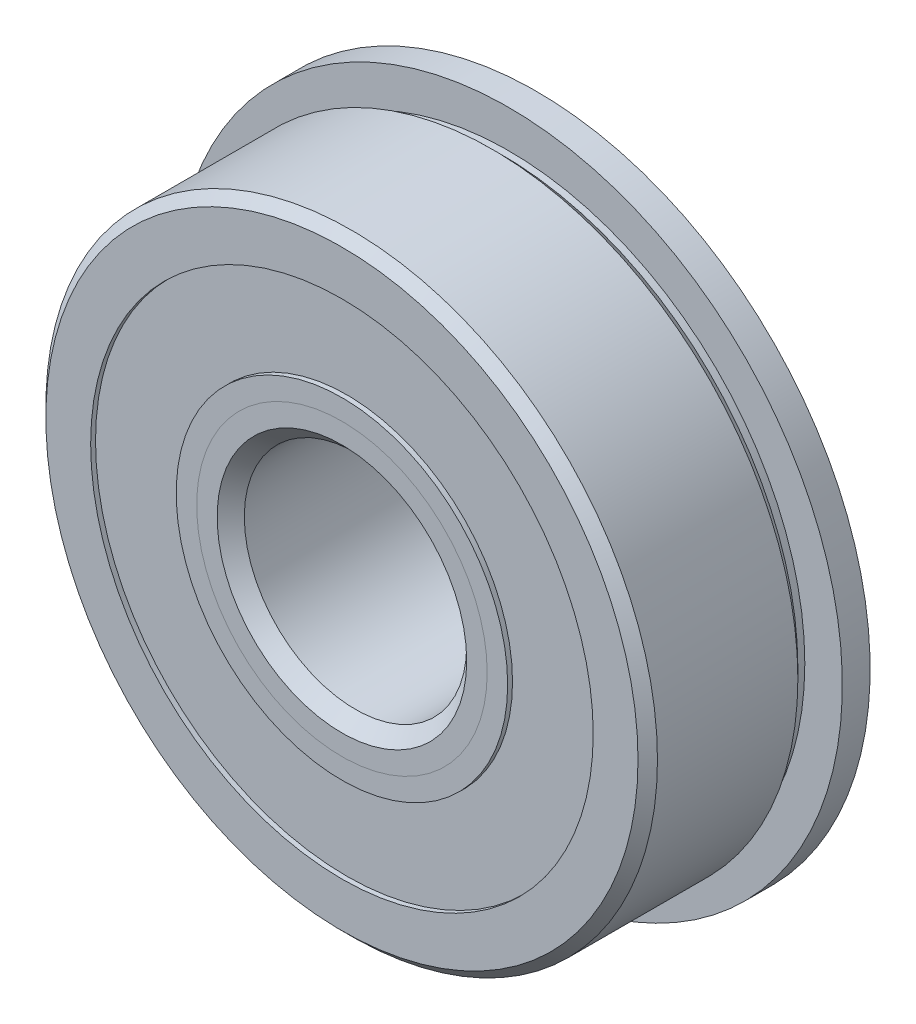
from build123d import *

# Parameters (mm, degrees)
SKETCH5_W          = 1.5875
SKETCH5_H          = 3.422283654
CIRPATTERN1_COUNT  = 12
SKETCH7_W          = 1.272755053
SKETCH7_H          = 4.884615384
SKETCH7_H_2        = 2.842357692
SKETCH9_R          = 9.4360365
SKETCH9_R_2        = 8.9757885
CUT_EXTRUDE1_DEPTH = 0.127
SKETCH10_R         = 12.426696
SKETCH10_R_2       = 11.5062
CUT_EXTRUDE2_DEPTH = 0.254


with BuildPart() as part:
    # Sketch8 → Revolve7 (revolve)
    with BuildSketch(Plane(origin=(0, 0, 0), x_dir=(0, 0, -1), z_dir=(1, 0, 0))):
        with BuildLine():
            Line((5.55625, 16.906875), (5.000625, 17.4625))
            Line((5.000625, 17.4625), (-5.000625, 17.4625))
            Line((-5.000625, 17.4625), (-5.55625, 16.906875))
            Line((-5.55625, 16.906875), (-5.55625, 14.348557692))
            Line((-5.55625, 14.348557692), (-3.175, 14.348557692))
            ThreePointArc((-3.175, 14.348557692), (0, 15.911932447), (3.175, 14.348557692))
            Line((3.175, 14.348557692), (5.55625, 14.348557692))
            Line((5.55625, 14.348557692), (5.55625, 16.906875))
        make_face()
    revolve(axis=Axis((0, 0, 5.55625), (0, 0, -1)))

    # Sketch5 → Revolve5 (revolve)
    with BuildSketch(Plane(origin=(0, 0, 0), x_dir=(0, 0, -1), z_dir=(1, 0, 0))):
        with Locations((4.7625, 17.338858173)):
            Rectangle(SKETCH5_W, SKETCH5_H)
    revolve(axis=Axis((0, 0, -7.14375), (0, 0, 1)))

    # Sketch6 → Cut-Revolve1 (revolve, cut)
    with BuildSketch(Plane(origin=(0, 0, 0), x_dir=(0, 0, -1), z_dir=(1, 0, 0))):
        Polygon((3.01625, 17.4625), (3.571875, 16.906875), (3.96875, 16.906875), (3.96875, 17.4625), align=None)
    revolve(axis=Axis((0, 0, 5.55625), (0, 0, -1)), mode=Mode.SUBTRACT)


with BuildPart() as body_2:
    # Sketch2 → Revolve2 (revolve)
    with BuildSketch(Plane(origin=(0, 0, 0), x_dir=(0, 0, -1), z_dir=(1, 0, 0))):
        with BuildLine():
            Line((-5.55625, 9.463942308), (-3.175, 9.463942308))
            ThreePointArc((-3.175, 9.463942308), (-1.76951728, 8.312602764), (0, 7.900567553))
            Line((0, 7.900567553), (0, 7.125283777))
            Line((0, 7.125283777), (-4.386920734, 7.125283777))
            Line((-4.386920734, 7.125283777), (-5.55625, 8.294613042))
            Line((-5.55625, 8.294613042), (-5.55625, 9.463942308))
        make_face()
    revolve(axis=Axis((0, 0, 5.55625), (0, 0, -1)))


with BuildPart() as body_3:
    # Sketch3 → Revolve3 (revolve)
    with BuildSketch(Plane(origin=(0, 0, 0), x_dir=(0, 0, -1), z_dir=(1, 0, 0))):
        with BuildLine():
            Line((-5.55625, 8.294613042), (-4.386920734, 7.125283777))
            Line((-4.386920734, 7.125283777), (0, 7.125283777))
            Line((0, 7.125283777), (0, 7.900567553))
            ThreePointArc((0, 7.900567553), (2.687286606, 8.935731095), (3.985655763, 11.5062))
            Line((3.985655763, 11.5062), (7.14375, 11.5062))
            Line((7.14375, 11.5062), (7.14375, 6.905625))
            Line((7.14375, 6.905625), (6.588125, 6.35))
            Line((6.588125, 6.35), (-4.780966223, 6.35))
            Line((-4.780966223, 6.35), (-5.55625, 7.125283777))
            Line((-5.55625, 7.125283777), (-5.55625, 8.294613042))
        make_face()
    revolve(axis=Axis((0, 0, 5.55625), (0, 0, -1)))

    # Sketch9 → Cut-Extrude1 (cut)
    with BuildSketch(Plane(origin=(0, 0, -7.14375), x_dir=(-1, 0, 0), z_dir=(0, 0, -1))):
        Circle(SKETCH9_R)
        Circle(SKETCH9_R_2, mode=Mode.SUBTRACT)
    extrude(amount=-CUT_EXTRUDE1_DEPTH, mode=Mode.SUBTRACT)


with BuildPart() as body_4:
    # Sketch4 → Revolve4 (revolve)
    with BuildSketch(Plane(origin=(0, 0, 0), x_dir=(0, 0, -1), z_dir=(1, 0, 0))):
        with BuildLine():
            Line((-4.005682447, 11.90625), (4.005682447, 11.90625))
            ThreePointArc((4.005682447, 11.90625), (0, 15.911932447), (-4.005682447, 11.90625))
        make_face()
    revolve(axis=Axis((0, 11.90625, 4.005682447), (0, 0, -1)))


with BuildPart() as cirpattern1_1:
    # CirPattern1: pattern copy
    add(body_4.part.rotate(Axis((0, 0, 5.55625), (0, 0, -1)), 1 * 360 / CIRPATTERN1_COUNT))


with BuildPart() as cirpattern1_2:
    # CirPattern1: pattern copy
    add(body_4.part.rotate(Axis((0, 0, 5.55625), (0, 0, -1)), 2 * 360 / CIRPATTERN1_COUNT))


with BuildPart() as cirpattern1_3:
    # CirPattern1: pattern copy
    add(body_4.part.rotate(Axis((0, 0, 5.55625), (0, 0, -1)), 3 * 360 / CIRPATTERN1_COUNT))


with BuildPart() as cirpattern1_4:
    # CirPattern1: pattern copy
    add(body_4.part.rotate(Axis((0, 0, 5.55625), (0, 0, -1)), 4 * 360 / CIRPATTERN1_COUNT))


with BuildPart() as cirpattern1_5:
    # CirPattern1: pattern copy
    add(body_4.part.rotate(Axis((0, 0, 5.55625), (0, 0, -1)), 5 * 360 / CIRPATTERN1_COUNT))


with BuildPart() as cirpattern1_6:
    # CirPattern1: pattern copy
    add(body_4.part.rotate(Axis((0, 0, 5.55625), (0, 0, -1)), 6 * 360 / CIRPATTERN1_COUNT))


with BuildPart() as cirpattern1_7:
    # CirPattern1: pattern copy
    add(body_4.part.rotate(Axis((0, 0, 5.55625), (0, 0, -1)), 7 * 360 / CIRPATTERN1_COUNT))


with BuildPart() as cirpattern1_8:
    # CirPattern1: pattern copy
    add(body_4.part.rotate(Axis((0, 0, 5.55625), (0, 0, -1)), 8 * 360 / CIRPATTERN1_COUNT))


with BuildPart() as cirpattern1_9:
    # CirPattern1: pattern copy
    add(body_4.part.rotate(Axis((0, 0, 5.55625), (0, 0, -1)), 9 * 360 / CIRPATTERN1_COUNT))


with BuildPart() as cirpattern1_10:
    # CirPattern1: pattern copy
    add(body_4.part.rotate(Axis((0, 0, 5.55625), (0, 0, -1)), 10 * 360 / CIRPATTERN1_COUNT))


with BuildPart() as cirpattern1_11:
    # CirPattern1: pattern copy
    add(body_4.part.rotate(Axis((0, 0, 5.55625), (0, 0, -1)), 11 * 360 / CIRPATTERN1_COUNT))


with BuildPart() as body_16:
    # Sketch7 → Revolve6 (revolve)
    with BuildSketch(Plane(origin=(0, 0, 0), x_dir=(0, 0, -1), z_dir=(1, 0, 0))):
        with Locations((-4.642059974, 11.90625)):
            Rectangle(SKETCH7_W, SKETCH7_H)
        with Locations((4.642059974, 12.927378846)):
            Rectangle(SKETCH7_W, SKETCH7_H_2)
    revolve(axis=Axis((0, 0, 5.55625), (0, 0, -1)))

    # Sketch10 → Cut-Extrude2 (cut)
    with BuildSketch(Plane(origin=(0, 0, -5.2784375), x_dir=(-1, 0, 0), z_dir=(0, 0, -1))):
        Circle(SKETCH10_R)
        Circle(SKETCH10_R_2, mode=Mode.SUBTRACT)
    extrude(amount=-CUT_EXTRUDE2_DEPTH, mode=Mode.SUBTRACT)


solid = Compound([part.part, body_2.part, body_3.part, body_4.part, cirpattern1_1.part, cirpattern1_2.part, cirpattern1_3.part, cirpattern1_4.part, cirpattern1_5.part, cirpattern1_6.part, cirpattern1_7.part, cirpattern1_8.part, cirpattern1_9.part, cirpattern1_10.part, cirpattern1_11.part, body_16.part])
